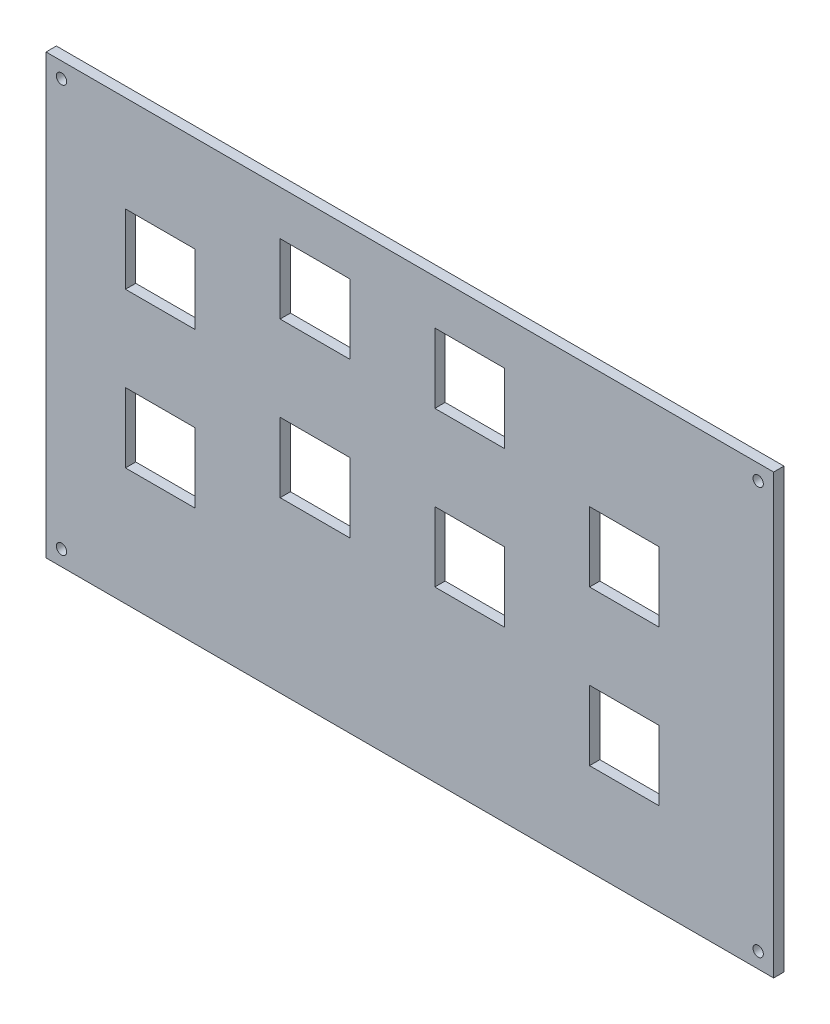
from build123d import *

# Parameters (mm, degrees)
SKETCH1_W           = 250
SKETCH1_H           = 123
SKETCH1_W_2         = 13.5
SKETCH1_H_2         = 13.5
BOSS_EXTRUDE1_DEPTH = 2
SKETCH3_W           = 250
SKETCH3_H           = 123
SKETCH3_W_2         = 141.095287024
SKETCH3_H_2         = 84.970220395
CUT_EXTRUDE2_DEPTH  = 62
SKETCH4_R           = 1
CUT_EXTRUDE3_DEPTH  = 62


with BuildPart() as part:
    # Sketch1 → Boss-Extrude1 (new body)
    with BuildSketch(Plane(origin=(0, 0, 0), x_dir=(-1, 0, 0), z_dir=(0, 0, 1))):
        Rectangle(SKETCH1_W, SKETCH1_H)
        with Locations((92, -31.5)):
            Rectangle(SKETCH1_W_2, SKETCH1_H_2, mode=Mode.SUBTRACT)
        with Locations((92, -1.5)):
            Rectangle(SKETCH1_W_2, SKETCH1_H_2, mode=Mode.SUBTRACT)
        with Locations((62, -41.5)):
            Rectangle(SKETCH1_W_2, SKETCH1_H_2, mode=Mode.SUBTRACT)
        with Locations((62, -11.5)):
            Rectangle(SKETCH1_W_2, SKETCH1_H_2, mode=Mode.SUBTRACT)
        with Locations((32, -41.5)):
            Rectangle(SKETCH1_W_2, SKETCH1_H_2, mode=Mode.SUBTRACT)
        with Locations((32, -11.5)):
            Rectangle(SKETCH1_W_2, SKETCH1_H_2, mode=Mode.SUBTRACT)
        with Locations((2, -26.5)):
            Rectangle(SKETCH1_W_2, SKETCH1_H_2, mode=Mode.SUBTRACT)
        with Locations((2, 3.5)):
            Rectangle(SKETCH1_W_2, SKETCH1_H_2, mode=Mode.SUBTRACT)
    extrude(amount=BOSS_EXTRUDE1_DEPTH)

    # Sketch3 → Cut-Extrude2 (cut)
    with BuildSketch(Plane.XY.offset(2)):
        Rectangle(SKETCH3_W, SKETCH3_H)
        with Locations((-43.596913119, 14.422576882)):
            Rectangle(SKETCH3_W_2, SKETCH3_H_2, mode=Mode.SUBTRACT)
    extrude(amount=-CUT_EXTRUDE2_DEPTH, mode=Mode.SUBTRACT)

    # Sketch4 → Cut-Extrude3 (cut)
    with BuildSketch(Plane.XY.offset(2)):
        with Locations((23.950730393, -25.062533315)):
            Circle(SKETCH4_R)
        with Locations((23.950730393, 53.90768708)):
            Circle(SKETCH4_R)
        with Locations((-111.144556631, 53.90768708)):
            Circle(SKETCH4_R)
        with Locations((-111.144556631, -25.062533315)):
            Circle(SKETCH4_R)
    extrude(amount=-CUT_EXTRUDE3_DEPTH, mode=Mode.SUBTRACT)


solid = part.part
